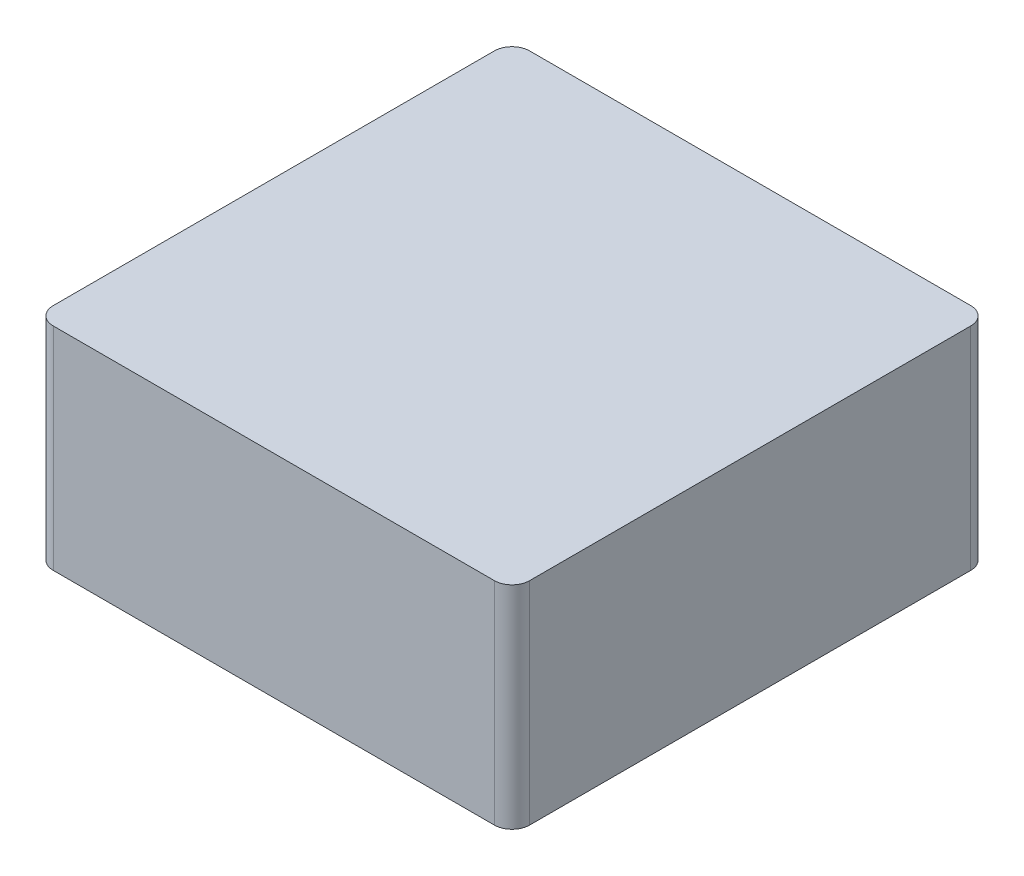
from build123d import *

# Parameters (mm, degrees)
SKETCH_1_W          = 54
SKETCH_1_H          = 54
EXTRUDE_1_DEPTH     = 24
FILLET_1_R          = 2
FILLET_2_R          = 2
FILLET_3_R          = 2
FILLET_4_R          = 2
CUT_EXTRUDE_1_DEPTH = 20
SKETCH_9_R          = 2.5
SKETCH_9_R_2        = 0.75
EXTRUDE_4_DEPTH     = 6.4


with BuildPart() as part:
    # 草图1 → 凸台-拉伸1 (new body)
    with BuildSketch(Plane(origin=(0, 0, 0), x_dir=(1, 0, 0), z_dir=(0, 1, 0))):
        Rectangle(SKETCH_1_W, SKETCH_1_H)
    extrude(amount=EXTRUDE_1_DEPTH)

    # 圆角1
    fillet_1_edges = [part.edges().sort_by_distance(p)[0] for p in [
        (-27, 12, 27),
    ]]
    fillet(fillet_1_edges, radius=FILLET_1_R)

    # 圆角2
    fillet_2_edges = [part.edges().sort_by_distance(p)[0] for p in [
        (-27, 12, -27),
    ]]
    fillet(fillet_2_edges, radius=FILLET_2_R)

    # 圆角3
    fillet_3_edges = [part.edges().sort_by_distance(p)[0] for p in [
        (27, 12, 27),
    ]]
    fillet(fillet_3_edges, radius=FILLET_3_R)

    # 圆角4
    fillet_4_edges = [part.edges().sort_by_distance(p)[0] for p in [
        (27, 12, -27),
    ]]
    fillet(fillet_4_edges, radius=FILLET_4_R)

    # 草图6 → 切除-拉伸1 (cut)
    with BuildSketch(Plane.XZ):
        with BuildLine():
            ThreePointArc((-25, 25.5), (-25.353553391, 25.353553391), (-25.5, 25))
            Line((-25.5, 25), (-25.5, -25))
            ThreePointArc((-25.5, -25), (-25.353553391, -25.353553391), (-25, -25.5))
            Line((-25, -25.5), (25, -25.5))
            ThreePointArc((25, -25.5), (25.353553391, -25.353553391), (25.5, -25))
            Line((25.5, -25), (25.5, 25))
            ThreePointArc((25.5, 25), (25.353553391, 25.353553391), (25, 25.5))
            Line((25, 25.5), (-25, 25.5))
        make_face()
    extrude(amount=-CUT_EXTRUDE_1_DEPTH, mode=Mode.SUBTRACT)

    # 草图9 → 凸台-拉伸4 (add)
    # profile 1 of 4: a face of its own
    with BuildSketch(Plane.XZ.offset(-20)):
        with Locations((-22.15, -22.5)):
            Circle(SKETCH_9_R)
        with Locations((-22.15, -22.5)):
            Circle(SKETCH_9_R_2, mode=Mode.SUBTRACT)
    # profile 2 of 4: a face of its own
    with BuildSketch(Plane.XZ.offset(-20)):
        with Locations((22.15, -22.5)):
            Circle(SKETCH_9_R)
        with Locations((22.15, -22.5)):
            Circle(SKETCH_9_R_2, mode=Mode.SUBTRACT)
    # profile 3 of 4: a face of its own
    with BuildSketch(Plane.XZ.offset(-20)):
        with Locations((22.15, 11.8)):
            Circle(SKETCH_9_R)
        with Locations((22.15, 11.8)):
            Circle(SKETCH_9_R_2, mode=Mode.SUBTRACT)
    # profile 4 of 4: a face of its own
    with BuildSketch(Plane.XZ.offset(-20)):
        with Locations((-22.15, 11.8)):
            Circle(SKETCH_9_R)
        with Locations((-22.15, 11.8)):
            Circle(SKETCH_9_R_2, mode=Mode.SUBTRACT)
    extrude(amount=EXTRUDE_4_DEPTH)


solid = part.part
